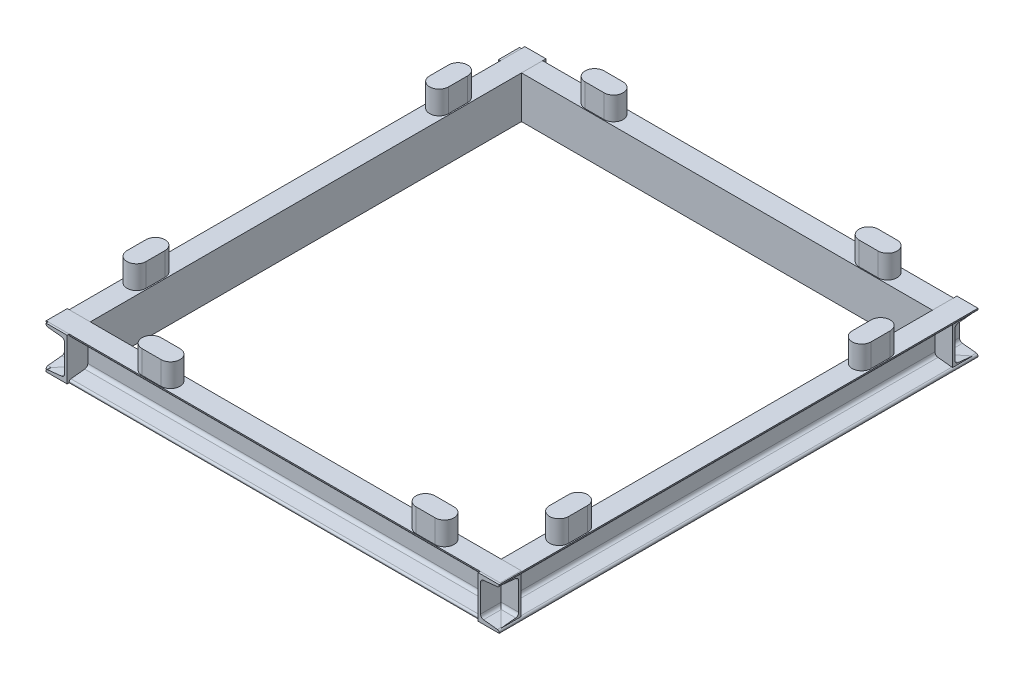
from build123d import *

# Parameters (mm, degrees)
C_CHANNEL_100_X_10_1_DEPTH   = 1135
C_CHANNEL_100_X_10_1_2_DEPTH = 1076
C_CHANNEL_100_X_10_1_3_DEPTH = 1135
C_CHANNEL_100_X_10_1_4_DEPTH = 1076
BOSS_EXTRUDE1_DEPTH          = 55
BOSS_EXTRUDE1_2_DEPTH        = 55
BOSS_EXTRUDE1_3_DEPTH        = 55
BOSS_EXTRUDE1_4_DEPTH        = 55
BOSS_EXTRUDE1_5_DEPTH        = 55
BOSS_EXTRUDE1_6_DEPTH        = 55
BOSS_EXTRUDE1_7_DEPTH        = 55
BOSS_EXTRUDE1_8_DEPTH        = 55


with BuildPart() as part:
    # Sketch12 → C channel 100 X 10(1) (new body)
    with BuildSketch(Plane(origin=(0, 0, 0), x_dir=(-1, 0, 0), z_dir=(0, 0, -1))):
        with BuildLine():
            Line((50, 100), (0, 100))
            Line((0, 100), (0, 0))
            Line((0, 0), (50, 0))
            Line((50, 0), (50, 1.629852671))
            ThreePointArc((50, 1.629852671), (48.844151715, 4.6409404), (45.970378085, 6.1052012))
            Line((45.970378085, 6.1052012), (13.063772294, 9.563824837))
            ThreePointArc((13.063772294, 9.563824837), (7.954841396, 12.166955149), (5.9, 17.52))
            Line((5.9, 17.52), (5.9, 82.48))
            ThreePointArc((5.9, 82.48), (7.954841396, 87.833044851), (13.063772294, 90.436175163))
            Line((13.063772294, 90.436175163), (45.970378085, 93.8947988))
            ThreePointArc((45.970378085, 93.8947988), (48.844151715, 95.3590596), (50, 98.370147329))
            Line((50, 98.370147329), (50, 100))
        make_face()
    extrude(amount=C_CHANNEL_100_X_10_1_DEPTH)


with BuildPart() as body_2:
    # Sketch12 on segment 2 (carried to segment 2) → C channel 100 X 10_1 2 (new body)
    with BuildSketch(Plane(origin=(0, 0, -1135), x_dir=(0, 0, -1), z_dir=(1, 0, 0))):
        with BuildLine():
            Line((50, 100), (0, 100))
            Line((0, 100), (0, 0))
            Line((0, 0), (50, 0))
            Line((50, 0), (50, 1.629852671))
            ThreePointArc((50, 1.629852671), (48.844151715, 4.6409404), (45.970378085, 6.1052012))
            Line((45.970378085, 6.1052012), (13.063772294, 9.563824837))
            ThreePointArc((13.063772294, 9.563824837), (7.954841396, 12.166955149), (5.9, 17.52))
            Line((5.9, 17.52), (5.9, 82.48))
            ThreePointArc((5.9, 82.48), (7.954841396, 87.833044851), (13.063772294, 90.436175163))
            Line((13.063772294, 90.436175163), (45.970378085, 93.8947988))
            ThreePointArc((45.970378085, 93.8947988), (48.844151715, 95.3590596), (50, 98.370147329))
            Line((50, 98.370147329), (50, 100))
        make_face()
    extrude(amount=C_CHANNEL_100_X_10_1_2_DEPTH)


with BuildPart() as body_3:
    # Sketch12 on segment 3 (carried to segment 3) → C channel 100 X 10_1 3 (new body)
    with BuildSketch(Plane(origin=(1076, 0, -1135), x_dir=(1, 0, 0), z_dir=(0, 0, 1))):
        with BuildLine():
            Line((50, 100), (0, 100))
            Line((0, 100), (0, 0))
            Line((0, 0), (50, 0))
            Line((50, 0), (50, 1.629852671))
            ThreePointArc((50, 1.629852671), (48.844151715, 4.6409404), (45.970378085, 6.1052012))
            Line((45.970378085, 6.1052012), (13.063772294, 9.563824837))
            ThreePointArc((13.063772294, 9.563824837), (7.954841396, 12.166955149), (5.9, 17.52))
            Line((5.9, 17.52), (5.9, 82.48))
            ThreePointArc((5.9, 82.48), (7.954841396, 87.833044851), (13.063772294, 90.436175163))
            Line((13.063772294, 90.436175163), (45.970378085, 93.8947988))
            ThreePointArc((45.970378085, 93.8947988), (48.844151715, 95.3590596), (50, 98.370147329))
            Line((50, 98.370147329), (50, 100))
        make_face()
    extrude(amount=C_CHANNEL_100_X_10_1_3_DEPTH)


with BuildPart() as body_4:
    # Sketch12 on segment 4 (carried to segment 4) → C channel 100 X 10_1 4 (new body)
    with BuildSketch(Plane.ZY.offset(-1076)):
        with BuildLine():
            Line((50, 100), (0, 100))
            Line((0, 100), (0, 0))
            Line((0, 0), (50, 0))
            Line((50, 0), (50, 1.629852671))
            ThreePointArc((50, 1.629852671), (48.844151715, 4.6409404), (45.970378085, 6.1052012))
            Line((45.970378085, 6.1052012), (13.063772294, 9.563824837))
            ThreePointArc((13.063772294, 9.563824837), (7.954841396, 12.166955149), (5.9, 17.52))
            Line((5.9, 17.52), (5.9, 82.48))
            ThreePointArc((5.9, 82.48), (7.954841396, 87.833044851), (13.063772294, 90.436175163))
            Line((13.063772294, 90.436175163), (45.970378085, 93.8947988))
            ThreePointArc((45.970378085, 93.8947988), (48.844151715, 95.3590596), (50, 98.370147329))
            Line((50, 98.370147329), (50, 100))
        make_face()
    extrude(amount=C_CHANNEL_100_X_10_1_4_DEPTH)


with BuildPart() as body_3_1:
    # Body-Move/Copy1: moved
    add(body_3.part.moved(Location((-47.443454547, 0, 0))))


with BuildPart() as part_1:
    # Body-Move/Copy2: moved
    add(part.part.moved(Location((54.553194501, 0, 0))))


with BuildPart() as body_4_1:
    # Body-Move/Copy3: moved
    add(body_4.part.moved(Location((0, 0, -54.928096215))))


with BuildPart() as body_2_1:
    # Body-Move/Copy4: moved
    add(body_2.part.moved(Location((0, 0, 57.970247848))))


with BuildPart() as body_5:
    # Sketch13 → Boss-Extrude1 (new body)
    with BuildSketch(Plane(origin=(0, 100, 0), x_dir=(1, 0, 0), z_dir=(0, 1, 0))):
        with BuildLine():
            Line((51.756442116, 951.955875345), (51.756442116, 906.955875345))
            ThreePointArc((51.756442116, 906.955875345), (29.256442116, 884.455875345), (6.756442116, 906.955875345))
            Line((6.756442116, 906.955875345), (6.756442116, 951.955875345))
            ThreePointArc((6.756442116, 951.955875345), (29.256442116, 974.455875345), (51.756442116, 951.955875345))
        make_face()
    extrude(amount=BOSS_EXTRUDE1_DEPTH)


with BuildPart() as body_6:
    # Sketch13 → Boss-Extrude1 2 (new body)
    with BuildSketch(Plane(origin=(0, 100, 0), x_dir=(1, 0, 0), z_dir=(0, 1, 0))):
        with BuildLine():
            Line((51.756442116, 234.762284533), (51.756442116, 189.762284533))
            ThreePointArc((51.756442116, 189.762284533), (29.256442116, 167.262284533), (6.756442116, 189.762284533))
            Line((6.756442116, 189.762284533), (6.756442116, 234.762284533))
            ThreePointArc((6.756442116, 234.762284533), (29.256442116, 257.262284533), (51.756442116, 234.762284533))
        make_face()
    extrude(amount=BOSS_EXTRUDE1_2_DEPTH)


with BuildPart() as body_7:
    # Sketch13 → Boss-Extrude1 3 (new body)
    with BuildSketch(Plane(origin=(0, 100, 0), x_dir=(1, 0, 0), z_dir=(0, 1, 0))):
        with BuildLine():
            Line((1075.862176769, 929.455875345), (1075.862176769, 884.455875345))
            ThreePointArc((1075.862176769, 884.455875345), (1053.362176769, 861.955875345), (1030.862176769, 884.455875345))
            Line((1030.862176769, 884.455875345), (1030.862176769, 929.455875345))
            ThreePointArc((1030.862176769, 929.455875345), (1053.362176769, 951.955875345), (1075.862176769, 929.455875345))
        make_face()
    extrude(amount=BOSS_EXTRUDE1_3_DEPTH)


with BuildPart() as body_8:
    # Sketch13 → Boss-Extrude1 4 (new body)
    with BuildSketch(Plane(origin=(0, 100, 0), x_dir=(1, 0, 0), z_dir=(0, 1, 0))):
        with BuildLine():
            Line((1075.862176769, 212.262284533), (1075.862176769, 167.262284533))
            ThreePointArc((1075.862176769, 167.262284533), (1053.362176769, 144.762284533), (1030.862176769, 167.262284533))
            Line((1030.862176769, 167.262284533), (1030.862176769, 212.262284533))
            ThreePointArc((1030.862176769, 212.262284533), (1053.362176769, 234.762284533), (1075.862176769, 212.262284533))
        make_face()
    extrude(amount=BOSS_EXTRUDE1_4_DEPTH)


with BuildPart() as body_9:
    # Sketch13 → Boss-Extrude1 5 (new body)
    with BuildSketch(Plane(origin=(0, 100, 0), x_dir=(1, 0, 0), z_dir=(0, 1, 0))):
        with BuildLine():
            Line((203.271104226, 1124.064320679), (248.271104226, 1124.064320679))
            ThreePointArc((248.271104226, 1124.064320679), (270.771104226, 1101.564320679), (248.271104226, 1079.064320679))
            Line((248.271104226, 1079.064320679), (203.271104226, 1079.064320679))
            ThreePointArc((203.271104226, 1079.064320679), (180.771104226, 1101.564320679), (203.271104226, 1124.064320679))
        make_face()
    extrude(amount=BOSS_EXTRUDE1_5_DEPTH)


with BuildPart() as body_10:
    # Sketch13 → Boss-Extrude1 6 (new body)
    with BuildSketch(Plane(origin=(0, 100, 0), x_dir=(1, 0, 0), z_dir=(0, 1, 0))):
        with BuildLine():
            Line((852.706720016, 1124.064320679), (897.706720016, 1124.064320679))
            ThreePointArc((897.706720016, 1124.064320679), (920.206720016, 1101.564320679), (897.706720016, 1079.064320679))
            Line((897.706720016, 1079.064320679), (852.706720016, 1079.064320679))
            ThreePointArc((852.706720016, 1079.064320679), (830.206720016, 1101.564320679), (852.706720016, 1124.064320679))
        make_face()
    extrude(amount=BOSS_EXTRUDE1_6_DEPTH)


with BuildPart() as body_11:
    # Sketch13 → Boss-Extrude1 7 (new body)
    with BuildSketch(Plane(origin=(0, 100, 0), x_dir=(1, 0, 0), z_dir=(0, 1, 0))):
        with BuildLine():
            Line((225.771104226, 51.408719734), (270.771104226, 51.408719734))
            ThreePointArc((270.771104226, 51.408719734), (293.271104226, 28.908719734), (270.771104226, 6.408719734))
            Line((270.771104226, 6.408719734), (225.771104226, 6.408719734))
            ThreePointArc((225.771104226, 6.408719734), (203.271104226, 28.908719734), (225.771104226, 51.408719734))
        make_face()
    extrude(amount=BOSS_EXTRUDE1_7_DEPTH)


with BuildPart() as body_12:
    # Sketch13 → Boss-Extrude1 8 (new body)
    with BuildSketch(Plane(origin=(0, 100, 0), x_dir=(1, 0, 0), z_dir=(0, 1, 0))):
        with BuildLine():
            Line((875.206720016, 51.408719734), (920.206720016, 51.408719734))
            ThreePointArc((920.206720016, 51.408719734), (942.706720016, 28.908719734), (920.206720016, 6.408719734))
            Line((920.206720016, 6.408719734), (875.206720016, 6.408719734))
            ThreePointArc((875.206720016, 6.408719734), (852.706720016, 28.908719734), (875.206720016, 51.408719734))
        make_face()
    extrude(amount=BOSS_EXTRUDE1_8_DEPTH)


solid = Compound([body_3_1.part, part_1.part, body_4_1.part, body_2_1.part, body_5.part, body_6.part, body_7.part, body_8.part, body_9.part, body_10.part, body_11.part, body_12.part])
